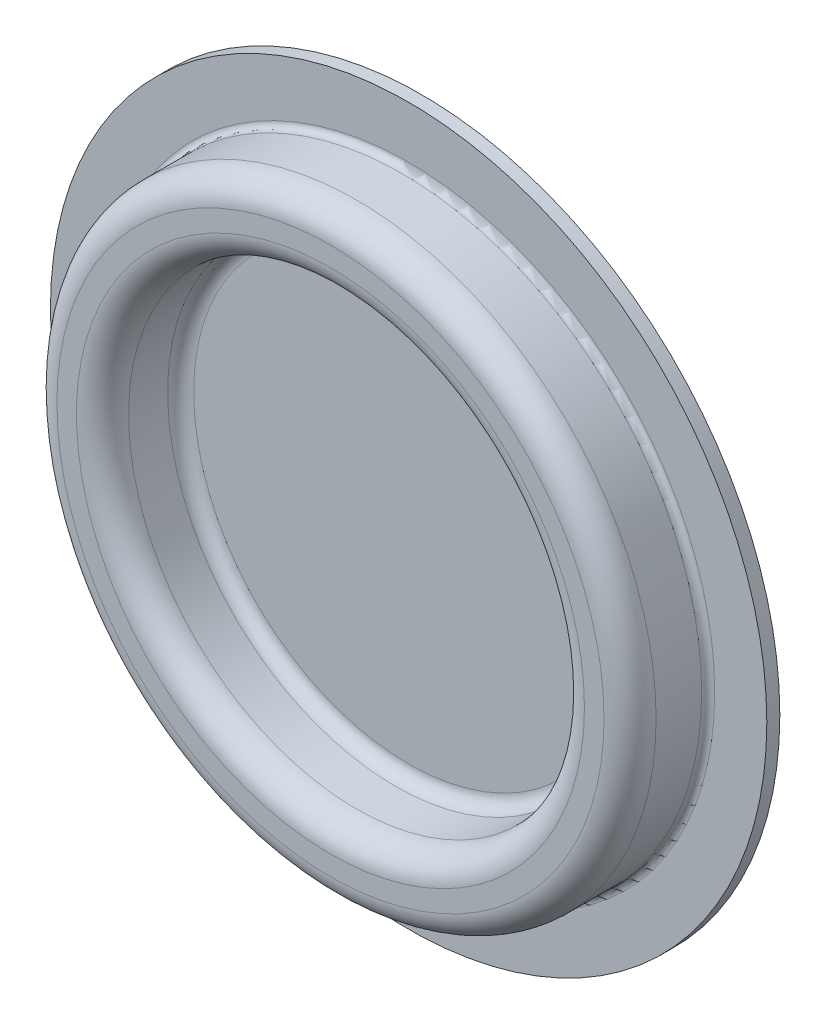
from build123d import *


with BuildPart() as part:
    # Croquis1 → Revolución1 (revolve)
    with BuildSketch(Plane(origin=(0, 0, 0), x_dir=(0, 0, -1), z_dir=(1, 0, 0)), mode=Mode.PRIVATE) as revoluci_n1_sk:
        with BuildLine():
            Line((-1, 27.5), (-1, 23.5))
            ThreePointArc((-1, 23.5), (-1.146446609, 23.146446609), (-1.5, 23))
            Line((-1.5, 23), (-5, 23))
            ThreePointArc((-5, 23), (-6.414213562, 22.414213562), (-7, 21))
            Line((-7, 21), (-7, 19.5))
            ThreePointArc((-7, 19.5), (-6.414213562, 18.085786438), (-5, 17.5))
            Line((-5, 17.5), (-2, 17.5))
            ThreePointArc((-2, 17.5), (-1.292893219, 17.207106781), (-1, 16.5))
            Line((-1, 16.5), (-1, 0))
            Line((-1, 0), (1.5e-08, 0))
            Line((1.5e-08, 0), (0, 16.5))
            ThreePointArc((0, 16.5), (-0.585786438, 17.914213562), (-2, 18.5))
            Line((-2, 18.5), (-5, 18.5))
            ThreePointArc((-5, 18.5), (-5.707106781, 18.792893219), (-6, 19.5))
            Line((-6, 19.5), (-6, 21))
            ThreePointArc((-6, 21), (-5.707106781, 21.707106781), (-5, 22))
            Line((-5, 22), (-1.5, 22))
            ThreePointArc((-1.5, 22), (-0.439339828, 22.439339828), (0, 23.5))
            Line((0, 23.5), (0, 27.5))
            Line((0, 27.5), (-1, 27.5))
        make_face()
    revolve(revoluci_n1_sk.sketch.rotate(Axis((0, 0, 74.476992057), (0, 0, -1)), 90), axis=Axis((0, 0, 74.476992057), (0, 0, -1)))


solid = part.part
